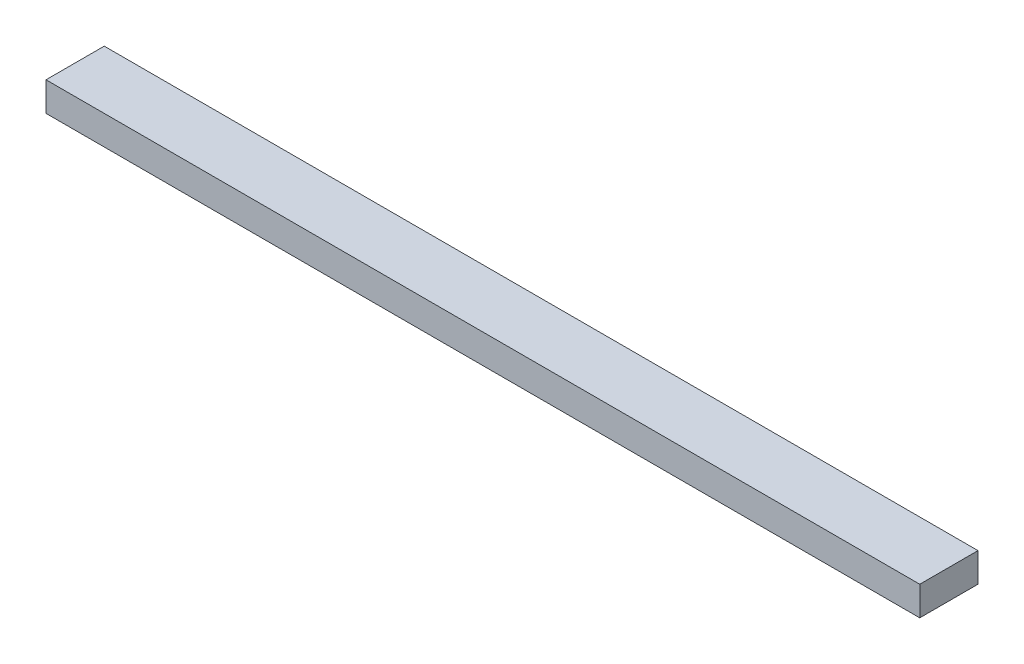
from build123d import *

# Parameters (mm, degrees)
SKETCH1_W           = 1524
SKETCH1_H           = 101.6
BOSS_EXTRUDE1_DEPTH = 50.8


with BuildPart() as part:
    # Sketch1 → Boss-Extrude1 (new body)
    with BuildSketch(Plane(origin=(0, 0, 0), x_dir=(1, 0, 0), z_dir=(0, 1, 0))):
        Rectangle(SKETCH1_W, SKETCH1_H)
    extrude(amount=BOSS_EXTRUDE1_DEPTH)


solid = part.part
